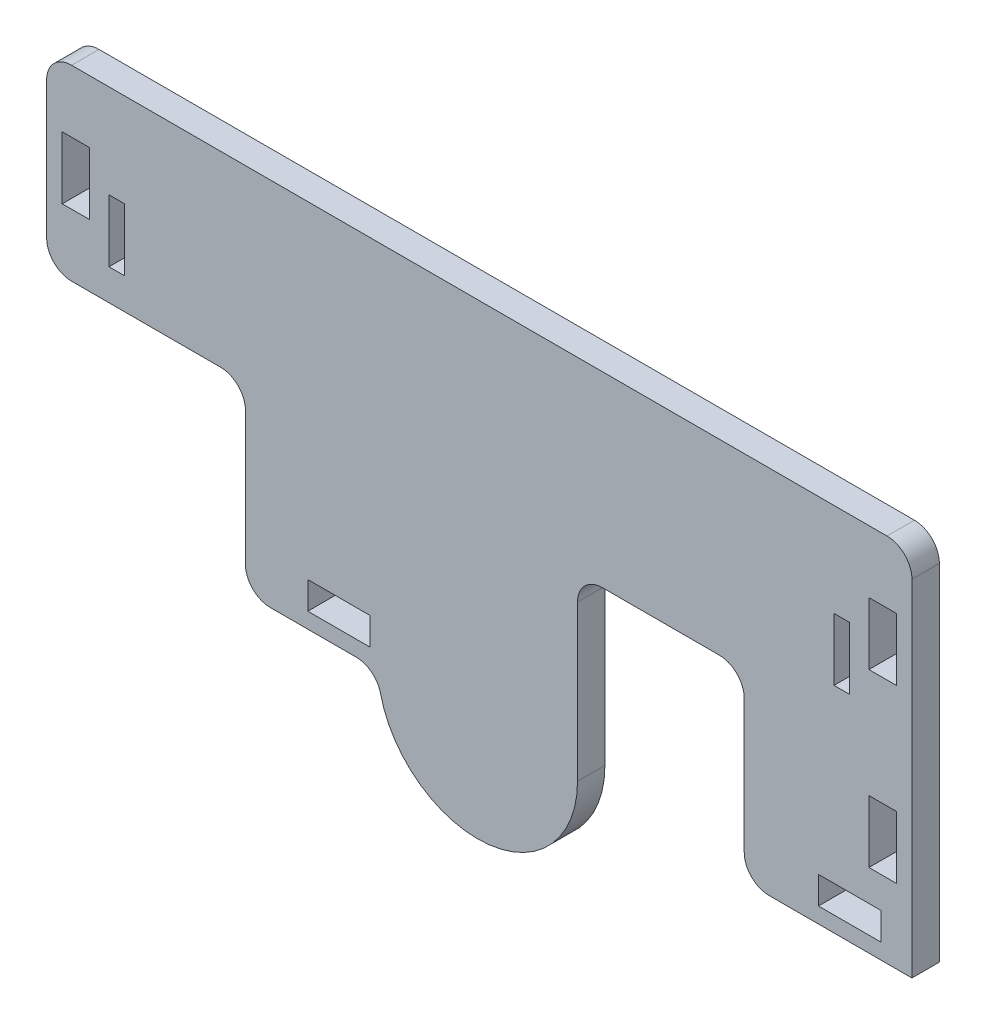
from build123d import *

# Parameters (mm, degrees)
BOSS_EXTRUDE1_DEPTH = 2.794
SKETCH3_W           = 2.794
SKETCH3_H           = 6.35
SKETCH3_W_2         = 1.5875
SKETCH3_W_3         = 6.35
SKETCH3_H_2         = 2.794
CUT_EXTRUDE1_DEPTH  = 78.110446656
FILLET1_R           = 2.54


with BuildPart() as part:
    # Sketch1 → Boss-Extrude1 (new body)
    with BuildSketch(Plane.XY):
        with BuildLine():
            Line((69.475359958, -4.3815), (69.475359958, 33.3375))
            Line((69.475359958, 33.3375), (-18.662640042, 33.3375))
            Line((-18.662640042, 33.3375), (-18.662640042, 14.2875))
            Line((-18.662640042, 14.2875), (1.5875, 14.2875))
            Line((1.5875, 14.2875), (1.5875, -4.3815))
            Line((1.5875, -4.3815), (15.094335312, -4.3815))
            ThreePointArc((15.094335312, -4.3815), (25.406359958, -14.226588915), (35.409491259, -4.0678))
            Line((35.409491259, -4.0678), (35.409491259, 14.2875))
            Line((35.409491259, 14.2875), (52.393859958, 14.2875))
            Line((52.393859958, 14.2875), (52.393859958, -4.3815))
            Line((52.393859958, -4.3815), (69.475359958, -4.3815))
        make_face()
    extrude(amount=BOSS_EXTRUDE1_DEPTH)

    # Sketch3 → Cut-Extrude1 (cut, through all)
    with BuildSketch(Plane.XY.offset(2.794)):
        with Locations((-15.678140042, 23.8125)):
            Rectangle(SKETCH3_W, SKETCH3_H)
        with Locations((66.490859958, 23.8125)):
            Rectangle(SKETCH3_W, SKETCH3_H)
        with Locations((66.490859958, 6.35)):
            Rectangle(SKETCH3_W, SKETCH3_H)
        with Locations((-11.518890042, 20.6375)):
            Rectangle(SKETCH3_W_2, SKETCH3_H)
        with Locations((62.331609958, 20.6375)):
            Rectangle(SKETCH3_W_2, SKETCH3_H)
        with Locations((11.1125, -1.397)):
            Rectangle(SKETCH3_W_3, SKETCH3_H_2)
        with Locations((63.125359958, -1.397)):
            Rectangle(SKETCH3_W_3, SKETCH3_H_2)
    extrude(amount=-CUT_EXTRUDE1_DEPTH, mode=Mode.SUBTRACT)

    # Fillet1
    fillet1_edges = [part.edges().sort_by_distance(p)[0] for p in [
        (1.5875, 14.2875, 1.397),
        (1.5875, -4.3815, 1.397),
        (52.393859958, -4.3815, 1.397),
        (35.409491259, 14.2875, 1.397),
        (52.393859958, 14.2875, 1.397),
        (-18.662640042, 33.3375, 1.397),
        (69.475359958, 33.3375, 1.397),
        (-18.662640042, 14.2875, 1.397),
        (15.094335312, -4.3815, 1.397),
    ]]
    fillet(fillet1_edges, radius=FILLET1_R)


solid = part.part
